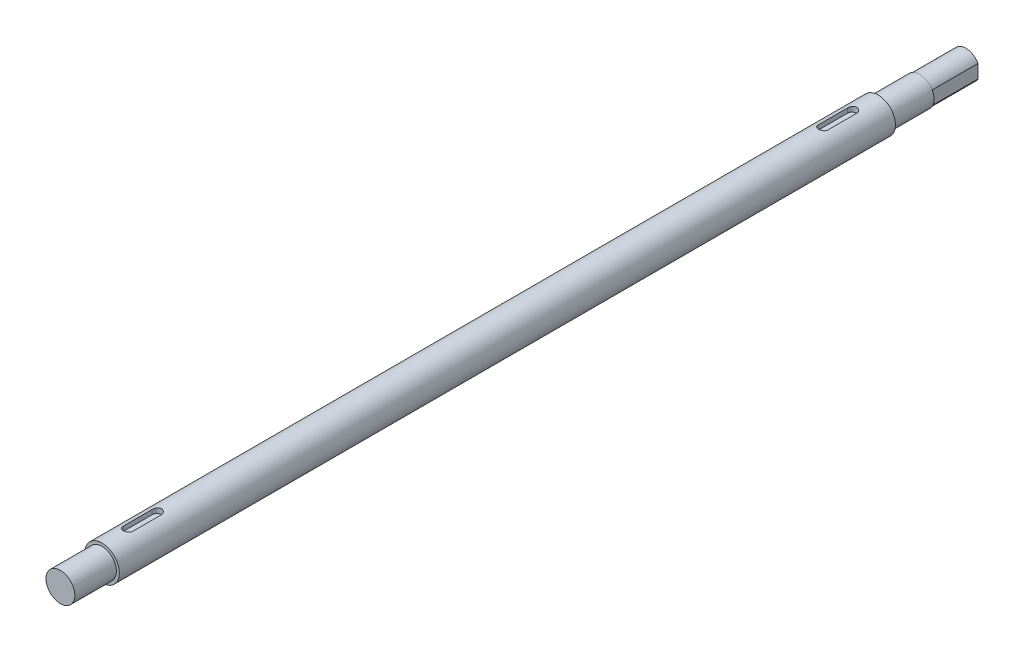
from build123d import *

# Parameters (mm, degrees)
SKETCH1_R           = 15
BOSS_EXTRUDE1_DEPTH = 672
SKETCH2_R           = 12.5
BOSS_EXTRUDE3_DEPTH = 36
BOSS_EXTRUDE4_START = 90
SKETCH3_R           = 12.5
BOSS_EXTRUDE4_DEPTH = 90
SKETCH6_R           = 13.02430926
SKETCH6_R_2         = 12
CUT_EXTRUDE3_DEPTH  = 54
CUT_EXTRUDE2_DEPTH  = 4.5
MOVE_FACE1_BY       = 14
SKETCH7_W           = 4
SKETCH7_H           = 18
CUT_EXTRUDE4_DEPTH  = 40


with BuildPart() as part:
    # Sketch1 → Boss-Extrude1 (new body)
    with BuildSketch(Plane.XY):
        with Locations(Location((0, 0, 0), (0, 0, 180))):
            Circle(SKETCH1_R)
    extrude(amount=BOSS_EXTRUDE1_DEPTH)

    # Sketch2 → Boss-Extrude3 (add)
    with BuildSketch(Plane.XY.offset(672)):
        Circle(SKETCH2_R)
    extrude(amount=BOSS_EXTRUDE3_DEPTH)

    # Sketch3 → Boss-Extrude4 (add)
    with BuildSketch(Plane(origin=(0, 0, 0), x_dir=(-1, 0, 0), z_dir=(0, 0, -1)).offset(BOSS_EXTRUDE4_START)):
        with Locations(Location((0, 0, 0), (0, 0, 180))):
            Circle(SKETCH3_R)
    extrude(amount=-BOSS_EXTRUDE4_DEPTH)

    # Sketch6 → Cut-Extrude3 (cut)
    with BuildSketch(Plane(origin=(0, 0, -90), x_dir=(-1, 0, 0), z_dir=(0, 0, -1))):
        Circle(SKETCH6_R)
        Circle(SKETCH6_R_2, mode=Mode.SUBTRACT)
    extrude(amount=-CUT_EXTRUDE3_DEPTH, mode=Mode.SUBTRACT)

    # Sketch5 → Cut-Extrude2 (cut)
    with BuildSketch(Plane(origin=(0, 15, 0), x_dir=(1, 0, 0), z_dir=(0, 1, 0))):
        with BuildLine():
            Line((4, -624.5), (4, -649.5))
            ThreePointArc((4, -649.5), (0, -653.5), (-4, -649.5))
            Line((-4, -649.5), (-4, -624.5))
            ThreePointArc((-4, -624.5), (0, -620.5), (4, -624.5))
        make_face()
        with BuildLine():
            Line((4, -47.5), (4, -22.5))
            ThreePointArc((4, -22.5), (0, -18.5), (-4, -22.5))
            Line((-4, -22.5), (-4, -47.5))
            ThreePointArc((-4, -47.5), (0, -51.5), (4, -47.5))
        make_face()
    extrude(amount=-CUT_EXTRUDE2_DEPTH, mode=Mode.SUBTRACT)

    # Move Face1: a face moved inward by 14.0
    extrude(part.faces().sort_by_distance((0, 0, -90))[0], amount=MOVE_FACE1_BY, dir=(0, 0, 1), mode=Mode.SUBTRACT)

    # Sketch7 → Cut-Extrude4 (cut)
    with BuildSketch(Plane(origin=(0, 0, -76), x_dir=(-1, 0, 0), z_dir=(0, 0, -1))):
        with Locations((12.5, 0)):
            Rectangle(SKETCH7_W, SKETCH7_H)
        with Locations((-12.5, 0)):
            Rectangle(SKETCH7_W, SKETCH7_H)
    extrude(amount=-CUT_EXTRUDE4_DEPTH, mode=Mode.SUBTRACT)


solid = part.part
